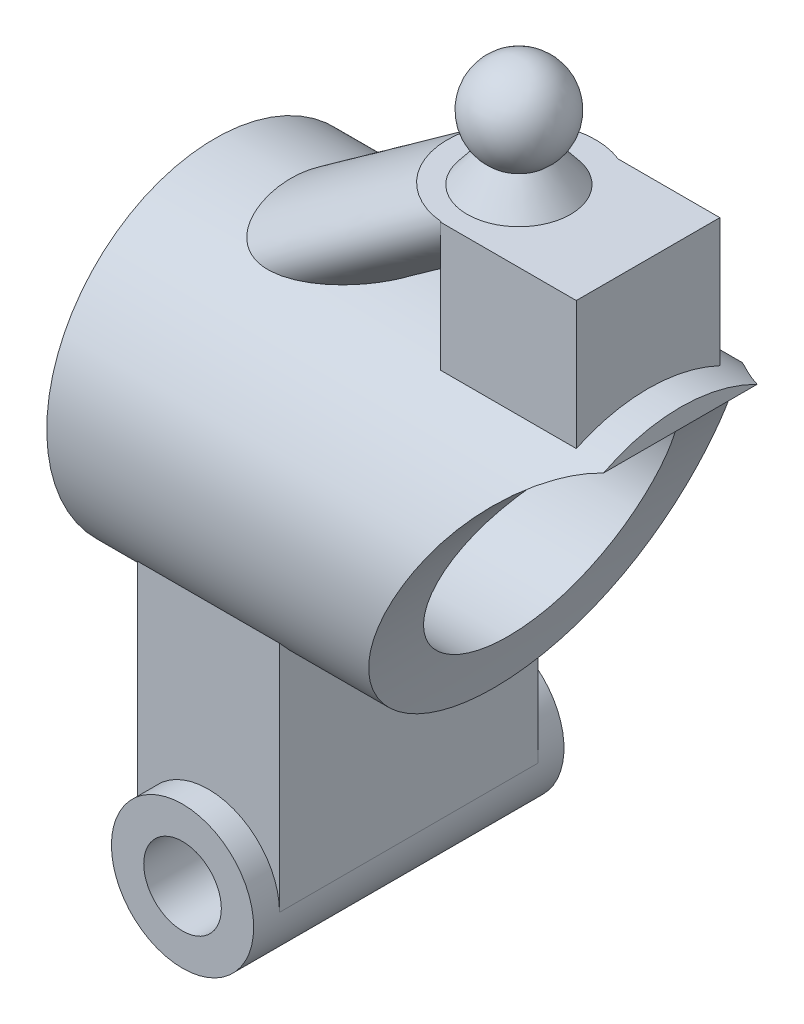
from build123d import *

# Parameters (mm, degrees)
SKETCH_1_R          = 1.5000000000000002
EXTRUDE_1_DEPTH     = 10
EXTRUDE_START       = 1
SKETCH_2_R          = 2.75
SKETCH_2_R_2        = 1.5000000000000002
EXTRUDE_2_DEPTH     = 1
SKETCH_3_R          = 2.75
SKETCH_3_R_2        = 1.5000000000000002
EXTRUDE_3_DEPTH     = 1
SKETCH_5_R          = 6.5
EXTRUDE_4_DEPTH     = 18
SKETCH_7_R          = 4.499999999999999
CUT_EXTRUDE_1_DEPTH = 18
SKETCH_9_R          = 2.8700119692288277
SKETCH_12_W         = 5.249259279764373
SKETCH_12_H         = 2.7755664511126334
SKETCH_12_H_2       = 2.7755664511126383
EXTRUDE_5_DEPTH     = 5
CUT_EXTRUDE_2_DEPTH = 20


with BuildPart() as part:
    # 草图1 → 凸台-拉伸1 (new body)
    with BuildSketch(Plane.XY):
        with BuildLine():
            Line((-2.75, 0), (-2.7500000000000004, 9.5))
            Line((-2.7500000000000004, 9.5), (2.7500000000000004, 9.5))
            Line((2.7500000000000004, 9.5), (2.75, 0))
            ThreePointArc((2.75, 0), (-5.1e-16, -2.75), (-2.75, 0))
        make_face()
        Circle(SKETCH_1_R, mode=Mode.SUBTRACT)
    extrude(amount=EXTRUDE_1_DEPTH)

    # 草图2 → 凸台-拉伸2 (add)
    with BuildSketch(Plane(origin=(0, 0, 0), x_dir=(-1, 0, 0), z_dir=(0, 0, -1)).offset(EXTRUDE_START)):
        Circle(SKETCH_2_R)
        Circle(SKETCH_2_R_2, mode=Mode.SUBTRACT)
    extrude(amount=-EXTRUDE_2_DEPTH)

    # 草图3 → 凸台-拉伸3 (add)
    with BuildSketch(Plane.XY.offset(10)):
        with Locations(Location((0, 0, 0), (0, 0, 180))):
            Circle(SKETCH_3_R)
        with Locations(Location((0, 0, 0), (0, 0, 180))):
            Circle(SKETCH_3_R_2, mode=Mode.SUBTRACT)
    extrude(amount=EXTRUDE_3_DEPTH)

    # 草图5 → 凸台-拉伸4 (add)
    with BuildSketch(Plane.ZY.offset(4.75)):
        with Locations(Location((5, 13.164932727725386, 0), (0, 0, 270))):
            Circle(SKETCH_5_R)
    extrude(amount=-EXTRUDE_4_DEPTH)

    # 草图7 → 切除-拉伸1 (cut)
    with BuildSketch(Plane.ZY.offset(4.75)):
        with Locations(Location((5, 13.164932727725386, 0), (0, 0, 270))):
            Circle(SKETCH_7_R)
    extrude(amount=-CUT_EXTRUDE_1_DEPTH, mode=Mode.SUBTRACT)

    # 扫描2: sweep along a path in 草图11
    with BuildLine(Plane(origin=(0, 0, 5), x_dir=(-1, 0, 0), z_dir=(0, 0, -1))) as sweep_2_path:
        Line((-7, 24), (0, 19))
    # 草图9 → 扫描2 (sweep)
    with BuildSketch(Plane(origin=(0, 19, 0), x_dir=(1, 0, 0), z_dir=(0, 1, 0))):
        with Locations((-0.00737750074134282, -4.885467390073623)):
            Circle(SKETCH_9_R)
    sweep(path=sweep_2_path.line)

    # 草图12 → 凸台-拉伸5 (add)
    with BuildSketch(Plane(origin=(0, 19, 0), x_dir=(1, 0, 0), z_dir=(0, 1, 0))):
        with Locations((9.375370360117813, -3.6122167744436835)):
            Rectangle(SKETCH_12_W, SKETCH_12_H)
        with Locations((9.375370360117813, -6.387783225556319)):
            Rectangle(SKETCH_12_W, SKETCH_12_H_2)
    extrude(amount=EXTRUDE_5_DEPTH)

    # 草图13 → 旋转1 (revolve)
    with BuildSketch(Plane(origin=(0, 0, 5), x_dir=(-1, 0, 0), z_dir=(0, 0, -1)), mode=Mode.PRIVATE) as revolve_1_sk:
        with BuildLine():
            Line((-7.006191849278699, 24), (-5.006191849278698, 24))
            Line((-5.006191849278698, 24), (-5.912975516058456, 25.133479583474696))
            ThreePointArc((-5.912975516058456, 25.133479583474696), (-5.354842290747966, 27.079262147512125), (-7.006191849278699, 28.25))
            Line((-7.006191849278699, 28.25), (-7.006191849278698, 26.5))
            Line((-7.006191849278698, 26.5), (-7.006191849278699, 24))
        make_face()
    revolve(revolve_1_sk.sketch.rotate(Axis((7.006191849278698, 26.5, 5), (5e-16, 1, 0)), 180), axis=Axis((7.006191849278698, 26.5, 5), (5e-16, 1, 0)))

    # 草图14 → 切除-拉伸2 (cut, symmetric)
    with BuildSketch(Plane(origin=(0, 0, 5), x_dir=(-1, 0, 0), z_dir=(0, 0, -1))):
        with BuildLine():
            Line((-13.5, 19), (-13.5, 6.499999999999999))
            Line((-13.5, 6.499999999999999), (-6.000000000000001, 6.499999999999999))
            add(Edge.make_bspline(
                [(-13.5, 19), (-11.192290817282267, 18.56878443157226), (-8.111749647069864, 14.147051950991559), (-6.7530537895194716, 9.319622020478048), (-6.000000000000001, 6.499999999999999)],
                knots=[0, 0, 0, 0, 0.42648903061023624, 1, 1, 1, 1], degree=3))
        make_face()
    extrude(amount=CUT_EXTRUDE_2_DEPTH, both=True, mode=Mode.SUBTRACT)


solid = part.part
